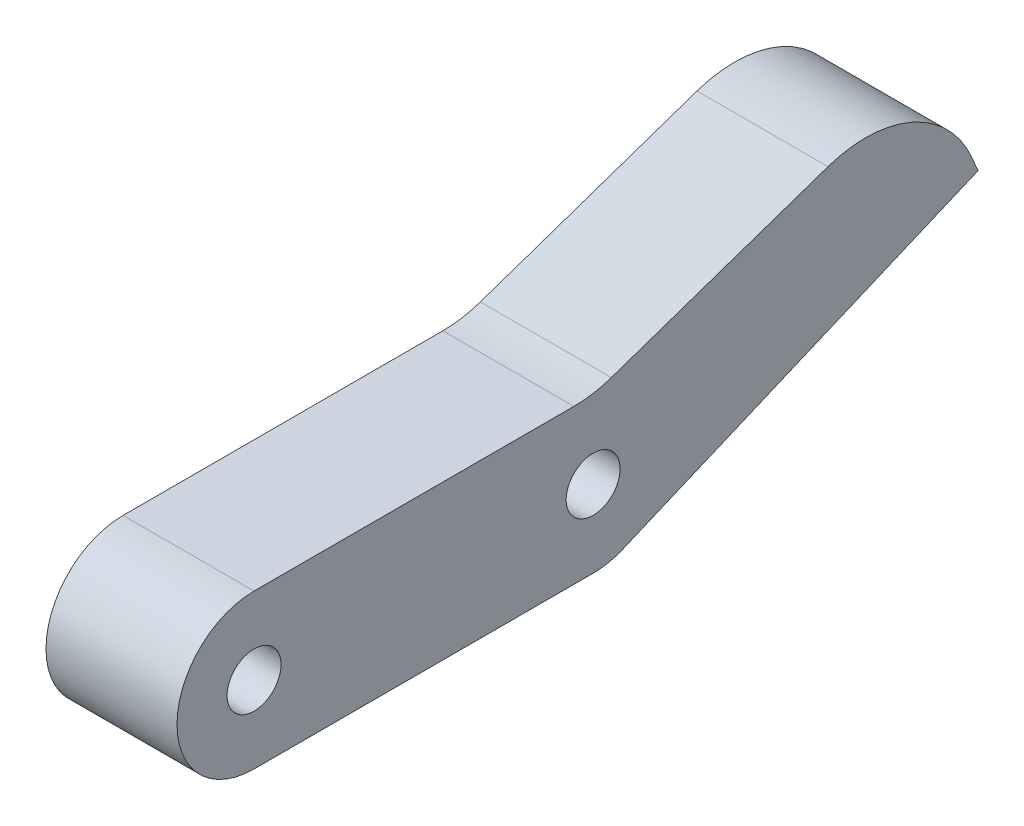
from build123d import *

# Parameters (mm, degrees)
SKETCH1_R           = 1.75
BOSS_EXTRUDE1_DEPTH = 8.5
BOSS_EXTRUDE2_START = -8.5
BOSS_EXTRUDE2_DEPTH = 8.5
FILLET1_R           = 7.5


with BuildPart() as part:
    # Sketch1 → Boss-Extrude1 (new body)
    with BuildSketch(Plane(origin=(0, 0, 0), x_dir=(0, 0, -1), z_dir=(1, 0, 0))):
        with BuildLine():
            Line((27, 10), (5, 10))
            ThreePointArc((5, 10), (0, 5), (5, 0))
            Line((5, 0), (27, 0))
            ThreePointArc((27, 0), (32, 5), (27, 10))
        make_face()
        with Locations((5, 5)):
            Circle(SKETCH1_R, mode=Mode.SUBTRACT)
        with Locations((27, 5)):
            Circle(SKETCH1_R, mode=Mode.SUBTRACT)
    extrude(amount=BOSS_EXTRUDE1_DEPTH)

    # Sketch2 → Boss-Extrude2 (add)
    with BuildSketch(Plane(origin=(8.5, 0, 0), x_dir=(0, 0, -1), z_dir=(1, 0, 0)).offset(BOSS_EXTRUDE2_START)):
        with BuildLine():
            Line((48.857901547, 17.499285579), (27, 10))
            ThreePointArc((27, 10), (31.900318254, 5.993418847), (28.947227404, 0.394752402))
            Line((28.947227404, 0.394752402), (51.973465393, 10.130889422))
            Line((51.973465393, 10.130889422), (48.857901547, 17.499285579))
        make_face()
    extrude(amount=BOSS_EXTRUDE2_DEPTH)

    # Fillet1
    fillet1_edges = [part.edges().sort_by_distance(p)[0] for p in [
        (4.25, 10, -27),
        (4.25, 17.499285579, -48.857901547),
    ]]
    fillet(fillet1_edges, radius=FILLET1_R)


solid = part.part
